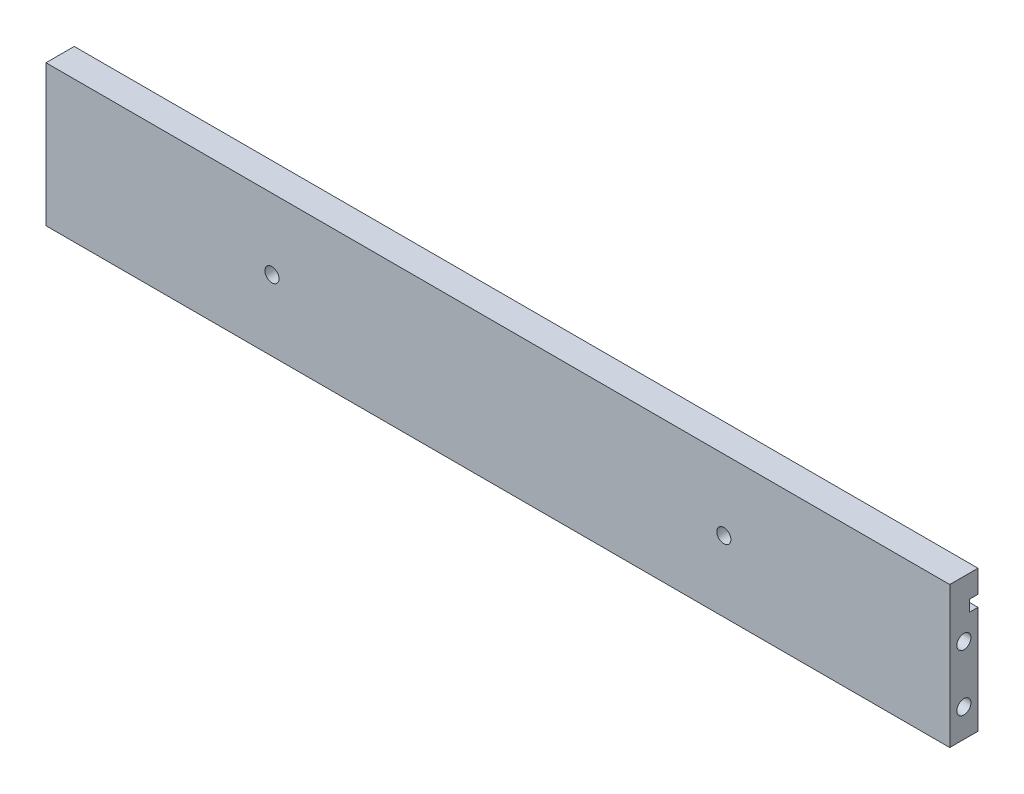
from build123d import *

# Parameters (mm, degrees)
SKETCH1_W           = 160
SKETCH1_H           = 25
BOSS_EXTRUDE1_DEPTH = 5
SKETCH2_R           = 1.25
SKETCH2_R_2         = 1.24
CUT_EXTRUDE1_DEPTH  = 10
SKETCH5_W           = 1.5
SKETCH5_H           = 2
CUT_EXTRUDE4_DEPTH  = 163.01851746
SKETCH6_R           = 1.25
CUT_EXTRUDE5_DEPTH  = 10
SKETCH7_R           = 1.25
CUT_EXTRUDE6_DEPTH  = 10
CUT_EXTRUDE7_START  = -10
SKETCH8_R           = 1.25
CUT_EXTRUDE7_DEPTH  = 10


with BuildPart() as part:
    # Sketch1 → Boss-Extrude1 (new body)
    with BuildSketch(Plane.XY):
        with Locations((80, 12.5)):
            Rectangle(SKETCH1_W, SKETCH1_H)
    extrude(amount=BOSS_EXTRUDE1_DEPTH)

    # Sketch2 → Cut-Extrude1 (cut)
    with BuildSketch(Plane.XZ):
        with Locations(Location((40, 2.5, 0), (0, 0, 270))):
            Circle(SKETCH2_R)
        with Locations(Location((120, 2.5, 0), (0, 0, 270))):
            Circle(SKETCH2_R_2)
    extrude(amount=-CUT_EXTRUDE1_DEPTH, mode=Mode.SUBTRACT)

    # Sketch5 → Cut-Extrude4 (cut, through all)
    with BuildSketch(Plane.ZY):
        with Locations((0.75, 20)):
            Rectangle(SKETCH5_W, SKETCH5_H)
    extrude(amount=-CUT_EXTRUDE4_DEPTH, mode=Mode.SUBTRACT)

    # Sketch6 → Cut-Extrude5 (cut)
    with BuildSketch(Plane.XY.offset(5)):
        with Locations((40, 12.5)):
            Circle(SKETCH6_R)
        with Locations((120, 12.5)):
            Circle(SKETCH6_R)
    extrude(amount=-CUT_EXTRUDE5_DEPTH, mode=Mode.SUBTRACT)

    # Sketch7 → Cut-Extrude6 (cut)
    with BuildSketch(Plane.ZY):
        with Locations((2.5, 5)):
            Circle(SKETCH7_R)
        with Locations((2.5, 15)):
            Circle(SKETCH7_R)
    extrude(amount=-CUT_EXTRUDE6_DEPTH, mode=Mode.SUBTRACT)

    # Sketch8 → Cut-Extrude7 (cut)
    with BuildSketch(Plane(origin=(160, 0, 0), x_dir=(0, 0, -1), z_dir=(1, 0, 0)).offset(CUT_EXTRUDE7_START)):
        with Locations(Location((-2.5, 5, 0), (0, 0, 180))):
            Circle(SKETCH8_R)
        with Locations(Location((-2.5, 15, 0), (0, 0, 180))):
            Circle(SKETCH8_R)
    extrude(amount=CUT_EXTRUDE7_DEPTH, mode=Mode.SUBTRACT)


solid = part.part
